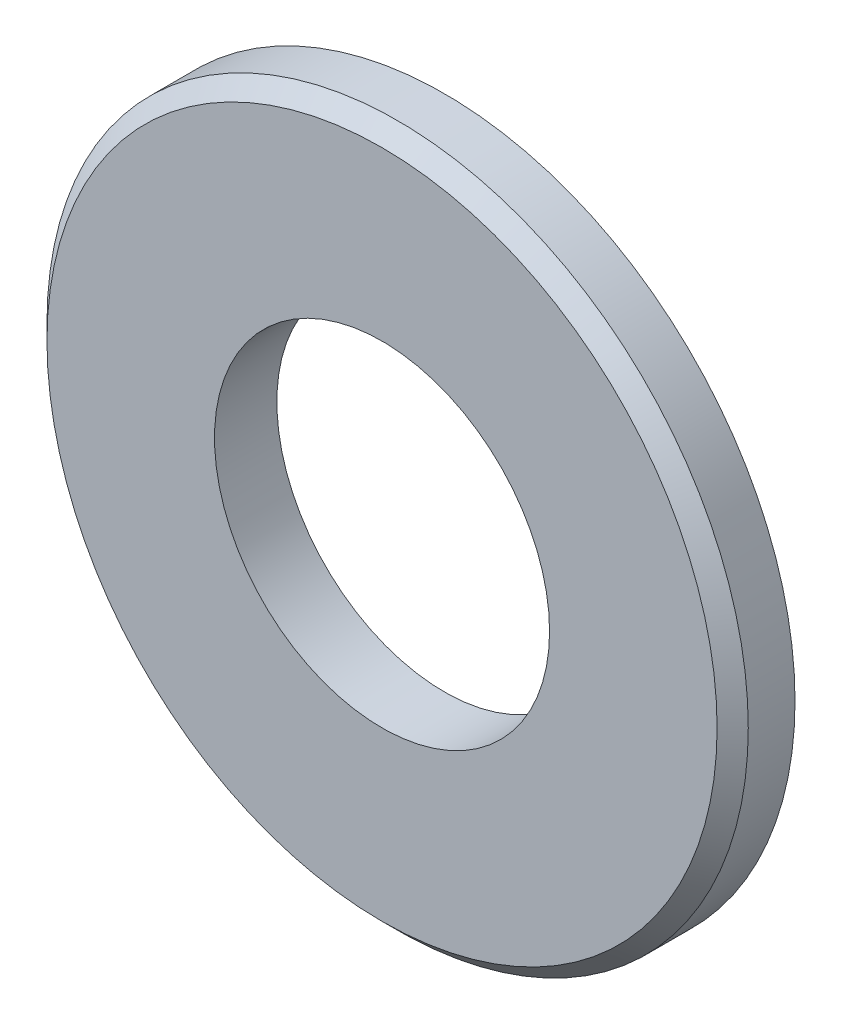
from build123d import *

# Parameters (mm, degrees)
SKETCH1_R          = 4.5
SKETCH1_R_2        = 2.15
BASE_EXTRUDE_DEPTH = 0.8
CHAMFER1_SIZE      = 0.2


with BuildPart() as part:
    # Sketch1 → Base-Extrude (new body)
    with BuildSketch(Plane.XY):
        Circle(SKETCH1_R)
        Circle(SKETCH1_R_2, mode=Mode.SUBTRACT)
    extrude(amount=-BASE_EXTRUDE_DEPTH)

    # Chamfer1
    chamfer1_edges = [part.edges().sort_by_distance(p)[0] for p in [
        (-4.5, 0, 0),
    ]]
    chamfer(chamfer1_edges, length=CHAMFER1_SIZE)


solid = part.part
